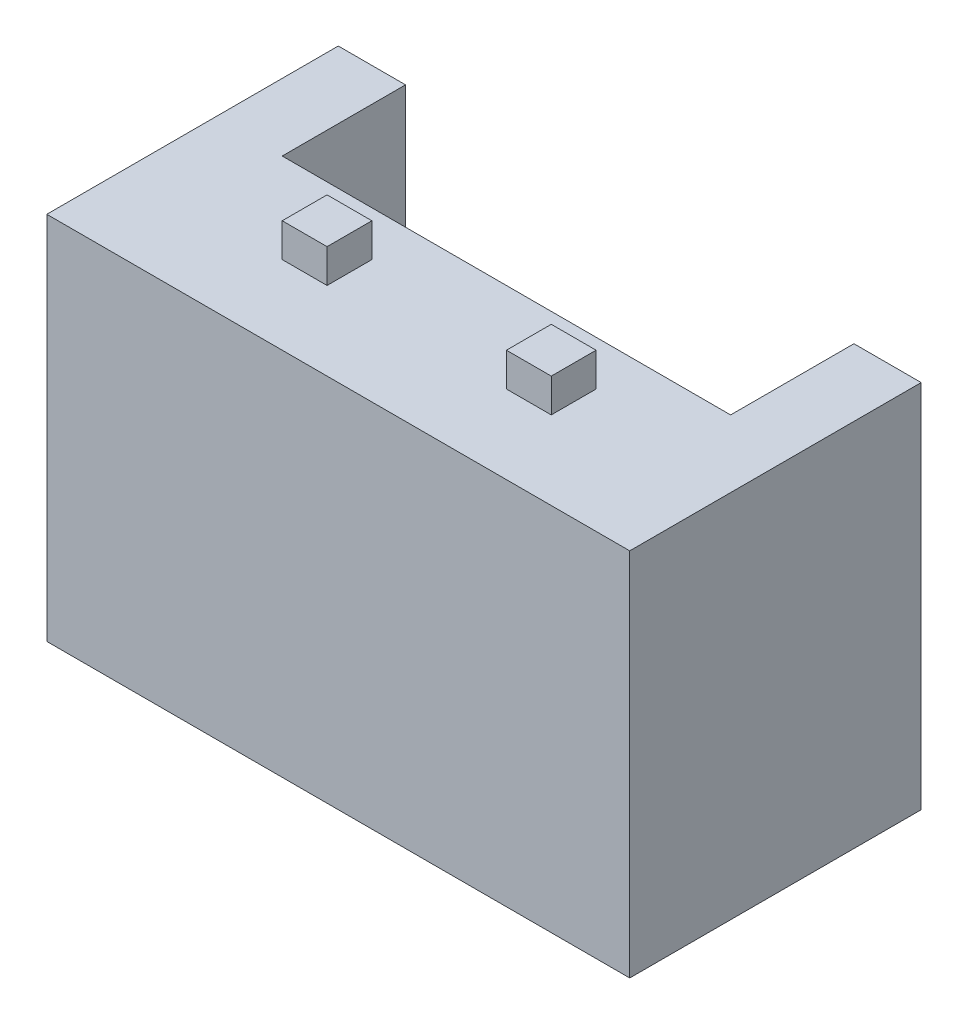
from build123d import *

# Parameters (mm, degrees)
EXTRUDE_1_DEPTH     = 16.5
SKETCH_2_W          = 4
SKETCH_2_H          = 5
CUT_EXTRUDE_1_DEPTH = 2
SKETCH_3_W          = 2
SKETCH_3_H          = 2
EXTRUDE_2_DEPTH     = 1.5


with BuildPart() as part:
    # Эскиз1 → Бобышка-Вытянуть1 (new body)
    with BuildSketch(Plane(origin=(0, 0, 0), x_dir=(1, 0, 0), z_dir=(0, 1, 0))):
        Polygon((-10, 1), (10, 1), (10, 6.5), (13, 6.5), (13, -6.5), (-13, -6.5), (-13, 6.5), (-10, 6.5), align=None)
    extrude(amount=EXTRUDE_1_DEPTH)

    # Эскиз2 → Вырез-Вытянуть1 (cut)
    with BuildSketch(Plane(origin=(0, 0, 0), x_dir=(-1, 0, 0), z_dir=(0, -1, 0))):
        with Locations((-5, -1.5)):
            Rectangle(SKETCH_2_W, SKETCH_2_H)
        with Locations((5, -1.5)):
            Rectangle(SKETCH_2_W, SKETCH_2_H)
    extrude(amount=-CUT_EXTRUDE_1_DEPTH, mode=Mode.SUBTRACT)

    # Эскиз3 → Бобышка-Вытянуть2 (add)
    with BuildSketch(Plane(origin=(0, 16.5, 0), x_dir=(1, 0, 0), z_dir=(0, 1, 0))):
        with Locations((-5, -2)):
            Rectangle(SKETCH_3_W, SKETCH_3_H)
        with Locations((5, -2)):
            Rectangle(SKETCH_3_W, SKETCH_3_H)
    extrude(amount=EXTRUDE_2_DEPTH)


solid = part.part
